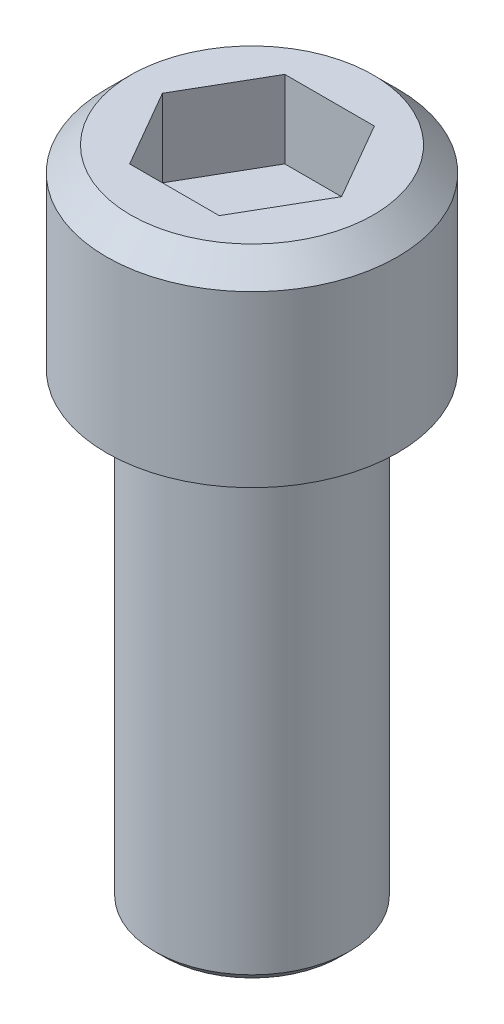
from build123d import *

# Parameters (mm, degrees)
CUT_EXTRUDE1_DEPTH = 6.35
CHAMFER1_SIZE      = 1.9812
CHAMFER2_SIZE      = 0.762


with BuildPart() as part:
    # Sketch1 → Base-Revolve (revolve)
    with BuildSketch(Plane.XY, mode=Mode.PRIVATE) as base_revolve_sk:
        Polygon((7.9502, 0), (11.9126, 0), (11.9126, 15.875), (0, 15.875), (0, -38.1), (7.9502, -38.1), align=None)
    revolve(base_revolve_sk.sketch.rotate(Axis((0, 0, 0), (0, 1, 0)), 90), axis=Axis((0, 0, 0), (0, 1, 0)))

    # Sketch2 → Cut-Extrude1 (cut)
    with BuildSketch(Plane(origin=(0, 15.875, 0), x_dir=(-1, 0, 0), z_dir=(0, 1, 0))):
        Polygon((3.666174209, -6.35), (-3.666174209, -6.35), (-7.332348419, 0), (-3.666174209, 6.35), (3.666174209, 6.35), (7.332348419, 0), align=None)
    extrude(amount=-CUT_EXTRUDE1_DEPTH, mode=Mode.SUBTRACT)

    # Chamfer1
    chamfer1_edges = [part.edges().sort_by_distance(p)[0] for p in [
        (0, 15.875, 11.9126),
    ]]
    chamfer(chamfer1_edges, length=CHAMFER1_SIZE)

    # Chamfer2
    chamfer2_edges = [part.edges().sort_by_distance(p)[0] for p in [
        (0, -38.1, 7.9502),
    ]]
    chamfer(chamfer2_edges, length=CHAMFER2_SIZE)


solid = part.part
